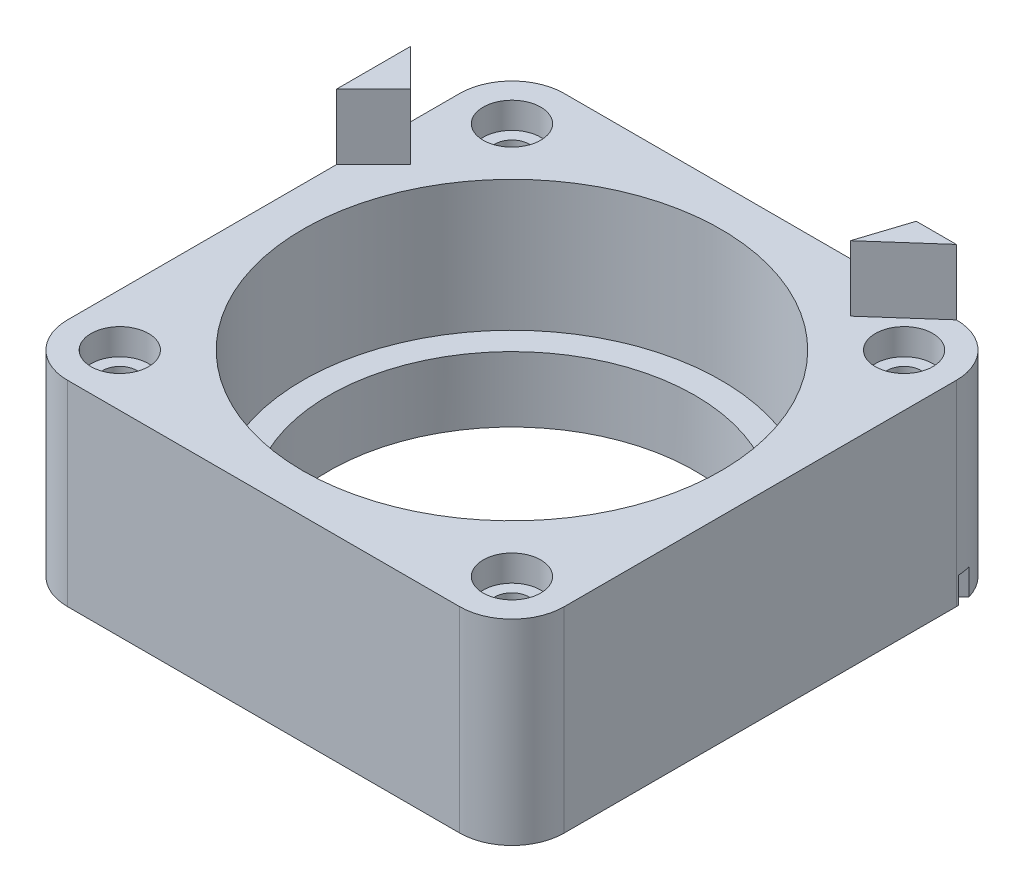
from build123d import *

# Parameters (mm, degrees)
SKETCH1_W                      = 38
SKETCH1_H                      = 38
BOSS_EXTRUDE1_DEPTH            = 15
SKETCH2_R                      = 16
CUT_EXTRUDE1_DEPTH             = 10
SKETCH2_3_R                    = 14
CUT_EXTRUDE3_DEPTH             = 31.773365107
FILLET1_R                      = 4
CBORE_FOR_M2_SHCS1_D           = 2.6
CBORE_FOR_M2_SHCS1_CBORE_D     = 4.4
CBORE_FOR_M2_SHCS1_CBORE_DEPTH = 2
CUT_EXTRUDE4_DEPTH             = 2
BOSS_EXTRUDE3_DEPTH            = 5


with BuildPart() as part:
    # Sketch1 → Boss-Extrude1 (new body)
    with BuildSketch(Plane(origin=(0, 0, 0), x_dir=(1, 0, 0), z_dir=(0, 1, 0))):
        Rectangle(SKETCH1_W, SKETCH1_H)
    extrude(amount=BOSS_EXTRUDE1_DEPTH)

    # Sketch2 → Cut-Extrude1 (cut)
    with BuildSketch(Plane(origin=(0, 15, 0), x_dir=(1, 0, 0), z_dir=(0, 1, 0))):
        Circle(SKETCH2_R)
    extrude(amount=-CUT_EXTRUDE1_DEPTH, mode=Mode.SUBTRACT)

    # Sketch2<3> → Cut-Extrude3 (cut, through all)
    with BuildSketch(Plane(origin=(0, 15, 0), x_dir=(1, 0, 0), z_dir=(0, 1, 0))):
        Circle(SKETCH2_3_R)
    extrude(amount=-CUT_EXTRUDE3_DEPTH, mode=Mode.SUBTRACT)

    # Fillet1
    fillet1_edges = [part.edges().sort_by_distance(p)[0] for p in [
        (-19, 7.5, 19),
        (19, 7.5, 19),
        (-19, 7.5, -19),
        (19, 7.5, -19),
    ]]
    fillet(fillet1_edges, radius=FILLET1_R)

    # CBORE for M2 SHCS1 (through all)
    with Locations(Plane(origin=(0, 15, 0), x_dir=(1, 0, 0), z_dir=(0, 1, 0))):
        with Locations((-15, 15), (15, 15), (-15, -15), (15, -15)):
            CounterBoreHole(CBORE_FOR_M2_SHCS1_D / 2, CBORE_FOR_M2_SHCS1_CBORE_D / 2, CBORE_FOR_M2_SHCS1_CBORE_DEPTH)

    # Sketch6 → Cut-Extrude4 (cut)
    with BuildSketch(Plane.XZ):
        Polygon((0.343583705, 2.476277496), (0.481017187, 3.466788495), (19, -15.155263686), (19, -16.283973067), align=None)
    extrude(amount=-CUT_EXTRUDE4_DEPTH, mode=Mode.SUBTRACT)

    # Sketch7 → Boss-Extrude3 (add)
    with BuildSketch(Plane(origin=(0, 15, 0), x_dir=(1, 0, 0), z_dir=(0, 1, 0))):
        Polygon((-19, 11.221825407), (-16.171572875, 8.393398282), (-19, 5.564971157), align=None)
        Polygon((11.932562755, 19), (10.700479231, 15.194481614), (15, 19), align=None)
    extrude(amount=BOSS_EXTRUDE3_DEPTH)


solid = part.part
